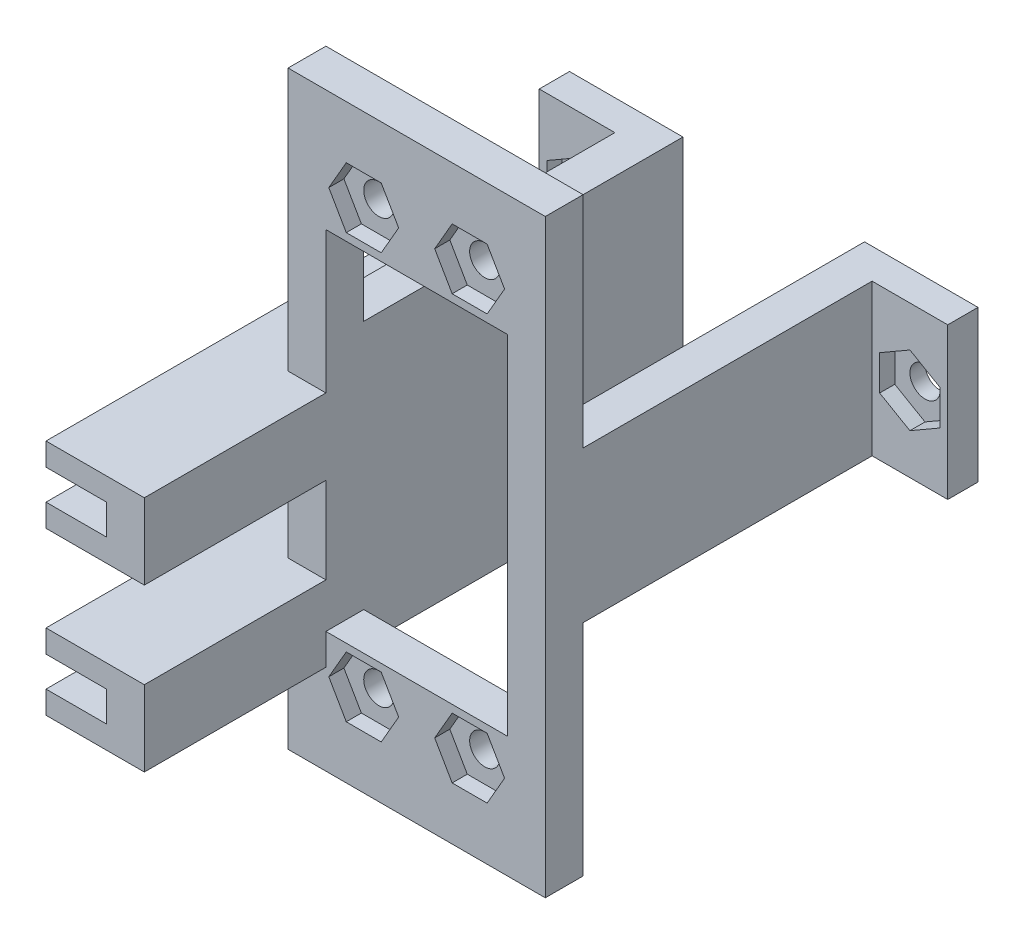
from build123d import *

# Parameters (mm, degrees)
SKETCH1_W                     = 17
SKETCH1_H                     = 39
SKETCH1_R                     = 1
SKETCH1_W_2                   = 12
SKETCH1_H_2                   = 23
SERVOBRACKET_DEPTH            = 2.5
SKETCH1_5_W                   = 2.5
SKETCH1_5_H                   = 10
SUPPORTLEGS_DEPTH             = 21.1
SKETCH2_W                     = 2
SKETCH2_H                     = 10
SUPPORTFOOT_DEPTH             = 5
SKETCH3_R                     = 1
BASEBOLTHOLE_DEPTH            = 47.581219392
SERVONUTSLOTS_DEPTH           = 1
BASENUTSLOTS_DEPTH            = 1
SKETCH6_W                     = 2.5
SKETCH6_H                     = 5
TUBEHOLDERBASE_DEPTH          = 12
SKETCH7_W                     = 4
SKETCH7_H                     = 1.5
TUBEHOLDERSTIFFENERRIBS_DEPTH = 30.6
SKETCH8_W                     = 1.5
SKETCH8_H                     = 1.5
SKETCH8_W_2                   = 1
SKETCH8_H_2                   = 1
TUBECLIPENTRANCES_DEPTH       = 1.7
SKETCH9_W                     = 0.9
SKETCH9_H                     = 1.5
TUBECLIPLOCKSLOT_DEPTH        = 0.6
SKETCH10_W                    = 0.9
SKETCH10_H                    = 1.5
TUBECLIPLOCKSLOT2_DEPTH       = 0.6
SUPPORTLEGEXTENSION_DEPTH     = 8.55


with BuildPart() as part:
    # Sketch1 → ServoBracket (new body)
    with BuildSketch(Plane.XY):
        with Locations((0, 19.5)):
            Rectangle(SKETCH1_W, SKETCH1_H)
        with Locations((-3.5, 33.5)):
            Circle(SKETCH1_R, mode=Mode.SUBTRACT)
        with Locations((-3.5, 5.5)):
            Circle(SKETCH1_R, mode=Mode.SUBTRACT)
        with Locations((3.5, 5.5)):
            Circle(SKETCH1_R, mode=Mode.SUBTRACT)
        with Locations((3.5, 33.5)):
            Circle(SKETCH1_R, mode=Mode.SUBTRACT)
        with Locations((0, 19.5)):
            Rectangle(SKETCH1_W_2, SKETCH1_H_2, mode=Mode.SUBTRACT)
    extrude(amount=SERVOBRACKET_DEPTH)

    # Sketch1<5> → SupportLegs (add)
    with BuildSketch(Plane.XY):
        with Locations((-7.25, 19.5)):
            Rectangle(SKETCH1_5_W, SKETCH1_5_H)
        with Locations((7.25, 19.5)):
            Rectangle(SKETCH1_5_W, SKETCH1_5_H)
    extrude(amount=-SUPPORTLEGS_DEPTH)

    # Sketch2 → SupportFoot (add)
    with BuildSketch(Plane.ZY.offset(8.5)):
        with Locations((-20.1, 19.5)):
            Rectangle(SKETCH2_W, SKETCH2_H)
    supportfoot = extrude(amount=SUPPORTFOOT_DEPTH)

    # Sketch3 → BaseBoltHole (cut, symmetric)
    with BuildSketch(Plane.XY.offset(-19.1)):
        with Locations((-11, 19.5)):
            Circle(SKETCH3_R)
    basebolthole = extrude(amount=BASEBOLTHOLE_DEPTH, both=True, mode=Mode.SUBTRACT)

    # SupportFoot2: SupportFoot, BaseBoltHole across plane
    add(supportfoot.mirror(Plane(origin=(0, 0, 0), x_dir=(0, 0, 1), z_dir=(1, 0, 0))))
    add(basebolthole.mirror(Plane(origin=(0, 0, 0), x_dir=(0, 0, 1), z_dir=(1, 0, 0))), mode=Mode.SUBTRACT)

    # Sketch4 → ServoNutSlots (cut)
    with BuildSketch(Plane.XY.offset(2.5)):
        Polygon((-4.654700538, 7.5), (-2.345299462, 7.5), (-1.190598923, 5.5), (-2.345299462, 3.5), (-4.654700538, 3.5), (-5.809401077, 5.5), align=None)
        Polygon((-1.190598923, 33.5), (-2.345299462, 35.5), (-4.654700538, 35.5), (-5.809401077, 33.5), (-4.654700538, 31.5), (-2.345299462, 31.5), align=None)
        Polygon((2.345299462, 31.5), (1.190598923, 33.5), (2.345299462, 35.5), (4.654700538, 35.5), (5.809401077, 33.5), (4.654700538, 31.5), align=None)
        Polygon((4.654700538, 7.5), (2.345299462, 7.5), (1.190598923, 5.5), (2.345299462, 3.5), (4.654700538, 3.5), (5.809401077, 5.5), align=None)
    extrude(amount=-SERVONUTSLOTS_DEPTH, mode=Mode.SUBTRACT)

    # Sketch5 → BaseNutSlots (cut)
    with BuildSketch(Plane.XY.offset(-19.1)):
        Polygon((-11, 21.809401077), (-13, 20.654700538), (-13, 18.345299462), (-11, 17.190598923), (-9, 18.345299462), (-9, 20.654700538), align=None)
        Polygon((11, 21.809401077), (9, 20.654700538), (9, 18.345299462), (11, 17.190598923), (13, 18.345299462), (13, 20.654700538), align=None)
    extrude(amount=-BASENUTSLOTS_DEPTH, mode=Mode.SUBTRACT)

    # Sketch6 → TubeHolderBase (add)
    with BuildSketch(Plane.XY.offset(2.5)):
        with Locations((-7.25, 19.15)):
            Rectangle(SKETCH6_W, SKETCH6_H)
    tubeholderbase = extrude(amount=TUBEHOLDERBASE_DEPTH)

    # Sketch7 → TubeHolderStiffenerRibs (add)
    with BuildSketch(Plane.XY.offset(14.5)):
        with Locations((-10.5, 20.9)):
            Rectangle(SKETCH7_W, SKETCH7_H)
        with Locations((-10.5, 17.4)):
            Rectangle(SKETCH7_W, SKETCH7_H)
    tubeholderstiffenerribs = extrude(amount=-TUBEHOLDERSTIFFENERRIBS_DEPTH)

    # TubeHolder2: TubeHolderBase, TubeHolderStiffenerRibs across plane
    add(tubeholderbase.mirror(Plane.ZX.offset(13.8)))
    add(tubeholderstiffenerribs.mirror(Plane.ZX.offset(13.8)))

    # Sketch8 → TubeClipEntrances (cut)
    # profile 1 of 4: a face of its own
    with BuildSketch(Plane.ZY.offset(8.5)):
        with Locations((10.3, 19.15)):
            Rectangle(SKETCH8_W, SKETCH8_H)
        with Locations((10.3, 19.15)):
            Rectangle(SKETCH8_W_2, SKETCH8_H_2, mode=Mode.SUBTRACT)
    # profile 2 of 4: a face of its own
    with BuildSketch(Plane.ZY.offset(8.5)):
        with Locations((10.3, 19.15)):
            Rectangle(SKETCH8_W_2, SKETCH8_H_2)
    # profile 3 of 4: a face of its own
    with BuildSketch(Plane.ZY.offset(8.5)):
        with Locations((11.1, 8.45)):
            Rectangle(SKETCH8_W, SKETCH8_H)
        with Locations((11.1, 8.45)):
            Rectangle(SKETCH8_W_2, SKETCH8_H_2, mode=Mode.SUBTRACT)
    # profile 4 of 4: a face of its own
    with BuildSketch(Plane.ZY.offset(8.5)):
        with Locations((11.1, 8.45)):
            Rectangle(SKETCH8_W_2, SKETCH8_H_2)
    extrude(amount=-TUBECLIPENTRANCES_DEPTH, mode=Mode.SUBTRACT)

    # Sketch9 → TubeClipLockSlot (cut)
    with BuildSketch(Plane(origin=(0, 0, 11.05), x_dir=(-1, 0, 0), z_dir=(0, 0, -1))):
        with Locations((7.25, 19.15)):
            Rectangle(SKETCH9_W, SKETCH9_H)
    extrude(amount=-TUBECLIPLOCKSLOT_DEPTH, mode=Mode.SUBTRACT)

    # Sketch10 → TubeClipLockSlot2 (cut)
    with BuildSketch(Plane(origin=(0, 0, 11.85), x_dir=(-1, 0, 0), z_dir=(0, 0, -1))):
        with Locations((7.25, 8.45)):
            Rectangle(SKETCH10_W, SKETCH10_H)
    extrude(amount=-TUBECLIPLOCKSLOT2_DEPTH, mode=Mode.SUBTRACT)

    # Sketch11 → SupportLegExtension (add)
    with BuildSketch(Plane.XZ.offset(-14.5)):
        Polygon((-6, 0), (-8.5, 0), (-8.5, -19.1), (-13.5, -19.1), (-13.5, -21.1), (-6, -21.1), align=None)
    extrude(amount=SUPPORTLEGEXTENSION_DEPTH)


solid = part.part
